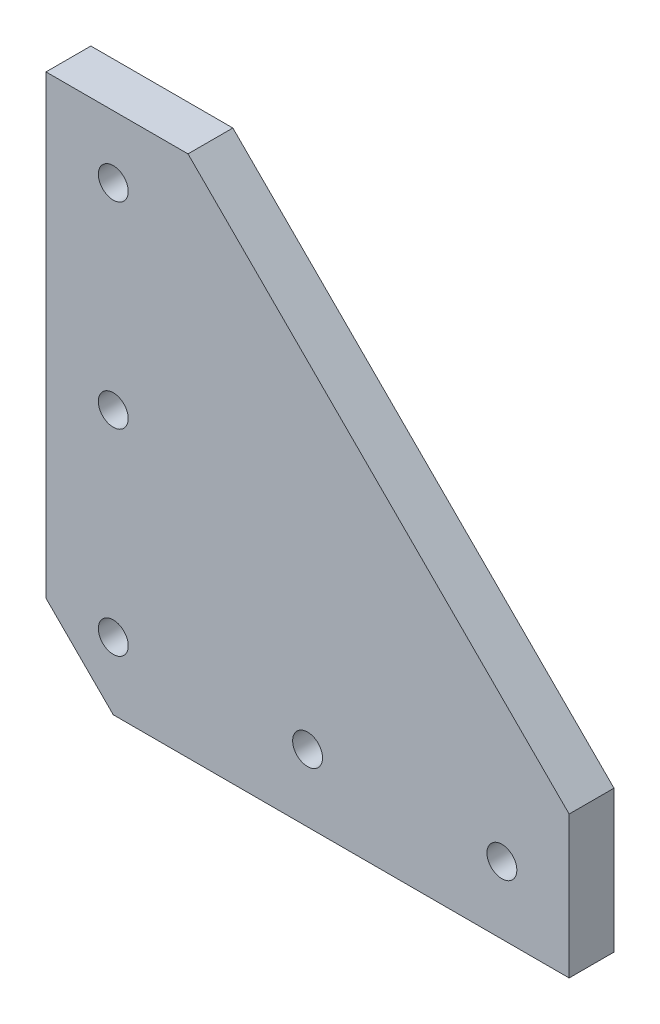
from build123d import *

# Parameters (mm, degrees)
SKETCH1_R           = 2
BOSS_EXTRUDE1_DEPTH = 6
CHAMFER1_SIZE       = 9


with BuildPart() as part:
    # Sketch1 → Boss-Extrude1 (new body)
    with BuildSketch(Plane.XY):
        Polygon((0, 70), (0, 0), (70, 0), (70, 19), (19, 70), align=None)
        with Locations((9, 9)):
            Circle(SKETCH1_R, mode=Mode.SUBTRACT)
        with Locations((35, 9)):
            Circle(SKETCH1_R, mode=Mode.SUBTRACT)
        with Locations((61, 9)):
            Circle(SKETCH1_R, mode=Mode.SUBTRACT)
        with Locations((9, 61.643837586)):
            Circle(SKETCH1_R, mode=Mode.SUBTRACT)
        with Locations((9, 35.321918793)):
            Circle(SKETCH1_R, mode=Mode.SUBTRACT)
    extrude(amount=BOSS_EXTRUDE1_DEPTH)

    # Chamfer1
    chamfer1_edges = [part.edges().sort_by_distance(p)[0] for p in [
        (0, 0, 3),
    ]]
    chamfer(chamfer1_edges, length=CHAMFER1_SIZE)


solid = part.part
